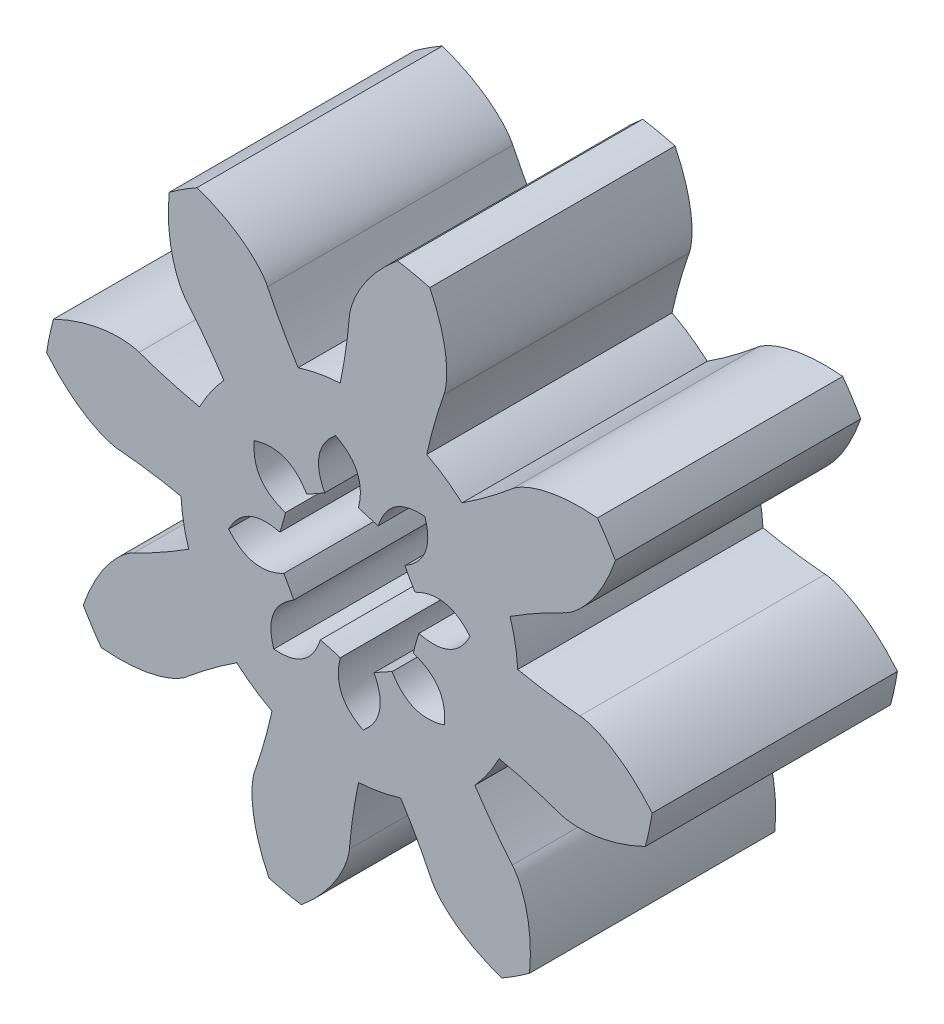
from build123d import *

# Parameters (mm, degrees)
EXTRUDE_1_DEPTH     = 6
CUT_EXTRUDE_2_DEPTH = 13.072478875


with BuildPart() as part:
    # 草图3 → 凸台-拉伸1 (new body)
    with BuildSketch(Plane.XY):
        with BuildLine():
            ThreePointArc((1.96696161, 7.237476219), (1.572644821, 7.333265866), (1.173724408, 7.407588745))
            add(Edge.make_bspline(
                [(0, 5.638155725), (0.000101301, 5.642726784), (0.000698877, 5.655536283), (0.003065727, 5.679693247), (0.008677882, 5.718928613), (0.018389094, 5.768580359), (0.033859291, 5.832228407), (0.055806057, 5.906403992), (0.083784426, 5.986918794), (0.118334002, 6.07327269), (0.156394653, 6.158200837), (0.19765593, 6.241670062), (0.24170094, 6.32361733), (0.298467235, 6.421345545), (0.371249724, 6.536317731), (0.463001824, 6.667175795), (0.57481499, 6.811191211), (0.696749171, 6.952856984), (0.823199958, 7.08792075), (0.958057827, 7.219031448), (1.061137976, 7.312626755), (1.134543326, 7.375061417), (1.172172164, 7.406301334), (1.173724408, 7.407588745)],
                knots=[0, 0, 0, 0, 0, 0.005376748, 0.015083688, 0.02853182, 0.046610139, 0.064854849, 0.092110525, 0.119476175, 0.146842495, 0.174208853, 0.201574955, 0.228941013, 0.256307345, 0.307035032, 0.361767351, 0.41649966, 0.471231936, 0.525964281, 0.580696615, 0.635428982, 0.637783596, 0.637783596, 0.637783596, 0.637783596, 0.637783596], degree=4))
            ThreePointArc((0, 5.638155725), (-0.088628717, 4.875171301), (-0.223287642, 4.118952249))
            ThreePointArc((-0.223287642, 4.118952249), (-0.744361744, 4.057283647), (-1.253391705, 3.929966187))
            ThreePointArc((-1.253391705, 3.929966187), (-1.647722087, 4.589135233), (-2.001421553, 5.270968767))
            add(Edge.make_bspline(
                [(-2.001421553, 5.270968767), (-2.003138882, 5.275206175), (-2.008244632, 5.286969324), (-2.019032532, 5.308712877), (-2.038206887, 5.343400834), (-2.064910933, 5.386371725), (-2.101967288, 5.44038309), (-2.148815468, 5.501937342), (-2.203552723, 5.567276881), (-2.266505983, 5.635742607), (-2.332235549, 5.701629081), (-2.400439414, 5.765015494), (-2.470705458, 5.825990904), (-2.558466198, 5.897203745), (-2.667321304, 5.978852139), (-2.799549757, 6.068618042), (-2.955203361, 6.16356318), (-3.119484774, 6.25271896), (-3.28564508, 6.334099394), (-3.458261702, 6.408799875), (-3.587852998, 6.459708563), (-3.678640733, 6.492019857), (-3.724908464, 6.507867851), (-3.72681662, 6.508520406)],
                knots=[0, 0, 0, 0, 0, 0.005376748, 0.015083688, 0.02853182, 0.046610139, 0.064854849, 0.092110525, 0.119476175, 0.146842495, 0.174208853, 0.201574955, 0.228941013, 0.256307345, 0.307035032, 0.361767351, 0.41649966, 0.471231936, 0.525964281, 0.580696615, 0.635428982, 0.637783596, 0.637783596, 0.637783596, 0.637783596, 0.637783596], degree=4))
            ThreePointArc((-3.72681662, 6.508520406), (-4.073374205, 6.29742984), (-4.408007746, 6.067904722))
            add(Edge.make_bspline(
                [(-3.986778146, 3.986778146), (-3.989938743, 3.990082004), (-3.998573876, 3.999562238), (-4.013981813, 4.018317406), (-4.037757014, 4.050029393), (-4.065999237, 4.092005343), (-4.100066122, 4.14795039), (-4.136997474, 4.215919156), (-4.174146342, 4.292635413), (-4.210777528, 4.378127078), (-4.243917852, 4.465093291), (-4.273763378, 4.553291075), (-4.300564322, 4.64238107), (-4.329528774, 4.751625185), (-4.359361394, 4.884387789), (-4.387013487, 5.041796946), (-4.409783915, 5.222695071), (-4.423736259, 5.409088386), (-4.429826555, 5.594007099), (-4.427176904, 5.782075277), (-4.420470108, 5.921145825), (-4.41271266, 6.017199219), (-4.408195011, 6.065896782), (-4.408007746, 6.067904722)],
                knots=[0, 0, 0, 0, 0, 0.005376748, 0.015083688, 0.02853182, 0.046610139, 0.064854849, 0.092110525, 0.119476175, 0.146842495, 0.174208853, 0.201574955, 0.228941013, 0.256307345, 0.307035032, 0.361767351, 0.41649966, 0.471231936, 0.525964281, 0.580696615, 0.635428982, 0.637783596, 0.637783596, 0.637783596, 0.637783596, 0.637783596], degree=4))
            ThreePointArc((-3.986778146, 3.986778146), (-3.509936653, 3.38459672), (-3.070427273, 2.754650861))
            ThreePointArc((-3.070427273, 2.754650861), (-3.395276017, 2.342589543), (-3.665187515, 1.892623967))
            ThreePointArc((-3.665187515, 1.892623967), (-4.410124104, 2.079893182), (-5.142356511, 2.311919007))
            add(Edge.make_bspline(
                [(-5.142356511, 2.311919007), (-5.146567146, 2.313700971), (-5.158495259, 2.318408463), (-5.181498469, 2.32615528), (-5.219584875, 2.337125052), (-5.268852496, 2.348627449), (-5.333247098, 2.360616451), (-5.409899193, 2.371015216), (-5.494806309, 2.378512162), (-5.587733565, 2.382410064), (-5.680800159, 2.382521015), (-5.773848537, 2.379114562), (-5.866650259, 2.372545092), (-5.979061557, 2.36084396), (-6.113767873, 2.341605909), (-6.270741587, 2.311580352), (-6.447941657, 2.268652984), (-6.627148815, 2.21553114), (-6.802186551, 2.155582718), (-6.977066152, 2.08634555), (-7.104698914, 2.030708544), (-7.191743073, 1.989359456), (-7.235665523, 1.967849454), (-7.237476219, 1.96696161)],
                knots=[0, 0, 0, 0, 0, 0.005376748, 0.015083688, 0.02853182, 0.046610139, 0.064854849, 0.092110525, 0.119476175, 0.146842495, 0.174208853, 0.201574955, 0.228941013, 0.256307345, 0.307035032, 0.361767351, 0.41649966, 0.471231936, 0.525964281, 0.580696615, 0.635428982, 0.637783596, 0.637783596, 0.637783596, 0.637783596, 0.637783596], degree=4))
            ThreePointArc((-7.237476219, 1.96696161), (-7.333265866, 1.572644821), (-7.407588745, 1.173724408))
            add(Edge.make_bspline(
                [(-5.638155725, 0), (-5.642726784, 0.000101301), (-5.655536283, 0.000698877), (-5.679693247, 0.003065727), (-5.718928613, 0.008677882), (-5.768580359, 0.018389094), (-5.832228407, 0.033859291), (-5.906403992, 0.055806057), (-5.986918794, 0.083784426), (-6.07327269, 0.118334002), (-6.158200837, 0.156394653), (-6.241670062, 0.19765593), (-6.32361733, 0.24170094), (-6.421345545, 0.298467235), (-6.536317731, 0.371249724), (-6.667175795, 0.463001824), (-6.811191211, 0.57481499), (-6.952856984, 0.696749171), (-7.08792075, 0.823199958), (-7.219031448, 0.958057827), (-7.312626755, 1.061137976), (-7.375061417, 1.134543326), (-7.406301334, 1.172172164), (-7.407588745, 1.173724408)],
                knots=[0, 0, 0, 0, 0, 0.005376748, 0.015083688, 0.02853182, 0.046610139, 0.064854849, 0.092110525, 0.119476175, 0.146842495, 0.174208853, 0.201574955, 0.228941013, 0.256307345, 0.307035032, 0.361767351, 0.41649966, 0.471231936, 0.525964281, 0.580696615, 0.635428982, 0.637783596, 0.637783596, 0.637783596, 0.637783596, 0.637783596], degree=4))
            ThreePointArc((-5.638155725, 0), (-4.875171301, -0.088628717), (-4.118952249, -0.223287642))
            ThreePointArc((-4.118952249, -0.223287642), (-4.057283647, -0.744361744), (-3.929966187, -1.253391705))
            ThreePointArc((-3.929966187, -1.253391705), (-4.589135233, -1.647722087), (-5.270968767, -2.001421553))
            add(Edge.make_bspline(
                [(-5.270968767, -2.001421553), (-5.275206175, -2.003138882), (-5.286969324, -2.008244632), (-5.308712877, -2.019032532), (-5.343400834, -2.038206887), (-5.386371725, -2.064910933), (-5.44038309, -2.101967288), (-5.501937342, -2.148815468), (-5.567276881, -2.203552723), (-5.635742607, -2.266505983), (-5.701629081, -2.332235549), (-5.765015494, -2.400439414), (-5.825990904, -2.470705458), (-5.897203745, -2.558466198), (-5.978852139, -2.667321304), (-6.068618042, -2.799549757), (-6.16356318, -2.955203361), (-6.25271896, -3.119484774), (-6.334099394, -3.28564508), (-6.408799875, -3.458261702), (-6.459708563, -3.587852998), (-6.492019857, -3.678640733), (-6.507867851, -3.724908464), (-6.508520406, -3.72681662)],
                knots=[0, 0, 0, 0, 0, 0.005376748, 0.015083688, 0.02853182, 0.046610139, 0.064854849, 0.092110525, 0.119476175, 0.146842495, 0.174208853, 0.201574955, 0.228941013, 0.256307345, 0.307035032, 0.361767351, 0.41649966, 0.471231936, 0.525964281, 0.580696615, 0.635428982, 0.637783596, 0.637783596, 0.637783596, 0.637783596, 0.637783596], degree=4))
            ThreePointArc((-6.508520406, -3.72681662), (-6.29742984, -4.073374205), (-6.067904722, -4.408007746))
            add(Edge.make_bspline(
                [(-3.986778146, -3.986778146), (-3.990082004, -3.989938743), (-3.999562238, -3.998573876), (-4.018317406, -4.013981813), (-4.050029393, -4.037757014), (-4.092005343, -4.065999237), (-4.14795039, -4.100066122), (-4.215919156, -4.136997474), (-4.292635413, -4.174146342), (-4.378127078, -4.210777528), (-4.465093291, -4.243917852), (-4.553291075, -4.273763378), (-4.64238107, -4.300564322), (-4.751625185, -4.329528774), (-4.884387789, -4.359361394), (-5.041796946, -4.387013487), (-5.222695071, -4.409783915), (-5.409088386, -4.423736259), (-5.594007099, -4.429826555), (-5.782075277, -4.427176904), (-5.921145825, -4.420470108), (-6.017199219, -4.41271266), (-6.065896782, -4.408195011), (-6.067904722, -4.408007746)],
                knots=[0, 0, 0, 0, 0, 0.005376748, 0.015083688, 0.02853182, 0.046610139, 0.064854849, 0.092110525, 0.119476175, 0.146842495, 0.174208853, 0.201574955, 0.228941013, 0.256307345, 0.307035032, 0.361767351, 0.41649966, 0.471231936, 0.525964281, 0.580696615, 0.635428982, 0.637783596, 0.637783596, 0.637783596, 0.637783596, 0.637783596], degree=4))
            ThreePointArc((-3.986778146, -3.986778146), (-3.38459672, -3.509936653), (-2.754650861, -3.070427273))
            ThreePointArc((-2.754650861, -3.070427273), (-2.342589543, -3.395276017), (-1.892623967, -3.665187515))
            ThreePointArc((-1.892623967, -3.665187515), (-2.079893182, -4.410124104), (-2.311919007, -5.142356511))
            add(Edge.make_bspline(
                [(-2.311919007, -5.142356511), (-2.313700971, -5.146567146), (-2.318408463, -5.158495259), (-2.32615528, -5.181498469), (-2.337125052, -5.219584875), (-2.348627449, -5.268852496), (-2.360616451, -5.333247098), (-2.371015216, -5.409899193), (-2.378512162, -5.494806309), (-2.382410064, -5.587733565), (-2.382521015, -5.680800159), (-2.379114562, -5.773848537), (-2.372545092, -5.866650259), (-2.36084396, -5.979061557), (-2.341605909, -6.113767873), (-2.311580352, -6.270741587), (-2.268652984, -6.447941657), (-2.21553114, -6.627148815), (-2.155582718, -6.802186551), (-2.08634555, -6.977066152), (-2.030708544, -7.104698914), (-1.989359456, -7.191743073), (-1.967849454, -7.235665523), (-1.96696161, -7.237476219)],
                knots=[0, 0, 0, 0, 0, 0.005376748, 0.015083688, 0.02853182, 0.046610139, 0.064854849, 0.092110525, 0.119476175, 0.146842495, 0.174208853, 0.201574955, 0.228941013, 0.256307345, 0.307035032, 0.361767351, 0.41649966, 0.471231936, 0.525964281, 0.580696615, 0.635428982, 0.637783596, 0.637783596, 0.637783596, 0.637783596, 0.637783596], degree=4))
            ThreePointArc((-1.96696161, -7.237476219), (-1.572644821, -7.333265866), (-1.173724408, -7.407588745))
            add(Edge.make_bspline(
                [(0, -5.638155725), (-0.000101301, -5.642726784), (-0.000698877, -5.655536283), (-0.003065727, -5.679693247), (-0.008677882, -5.718928613), (-0.018389094, -5.768580359), (-0.033859291, -5.832228407), (-0.055806057, -5.906403992), (-0.083784426, -5.986918794), (-0.118334002, -6.07327269), (-0.156394653, -6.158200837), (-0.19765593, -6.241670062), (-0.24170094, -6.32361733), (-0.298467235, -6.421345545), (-0.371249724, -6.536317731), (-0.463001824, -6.667175795), (-0.57481499, -6.811191211), (-0.696749171, -6.952856984), (-0.823199958, -7.08792075), (-0.958057827, -7.219031448), (-1.061137976, -7.312626755), (-1.134543326, -7.375061417), (-1.172172164, -7.406301334), (-1.173724408, -7.407588745)],
                knots=[0, 0, 0, 0, 0, 0.005376748, 0.015083688, 0.02853182, 0.046610139, 0.064854849, 0.092110525, 0.119476175, 0.146842495, 0.174208853, 0.201574955, 0.228941013, 0.256307345, 0.307035032, 0.361767351, 0.41649966, 0.471231936, 0.525964281, 0.580696615, 0.635428982, 0.637783596, 0.637783596, 0.637783596, 0.637783596, 0.637783596], degree=4))
            ThreePointArc((0, -5.638155725), (0.088628717, -4.875171301), (0.223287642, -4.118952249))
            ThreePointArc((0.223287642, -4.118952249), (0.744361744, -4.057283647), (1.253391705, -3.929966187))
            ThreePointArc((1.253391705, -3.929966187), (1.647722087, -4.589135233), (2.001421553, -5.270968767))
            add(Edge.make_bspline(
                [(2.001421553, -5.270968767), (2.003138882, -5.275206175), (2.008244632, -5.286969324), (2.019032532, -5.308712877), (2.038206887, -5.343400834), (2.064910933, -5.386371725), (2.101967288, -5.44038309), (2.148815468, -5.501937342), (2.203552723, -5.567276881), (2.266505983, -5.635742607), (2.332235549, -5.701629081), (2.400439414, -5.765015494), (2.470705458, -5.825990904), (2.558466198, -5.897203745), (2.667321304, -5.978852139), (2.799549757, -6.068618042), (2.955203361, -6.16356318), (3.119484774, -6.25271896), (3.28564508, -6.334099394), (3.458261702, -6.408799875), (3.587852998, -6.459708563), (3.678640733, -6.492019857), (3.724908464, -6.507867851), (3.72681662, -6.508520406)],
                knots=[0, 0, 0, 0, 0, 0.005376748, 0.015083688, 0.02853182, 0.046610139, 0.064854849, 0.092110525, 0.119476175, 0.146842495, 0.174208853, 0.201574955, 0.228941013, 0.256307345, 0.307035032, 0.361767351, 0.41649966, 0.471231936, 0.525964281, 0.580696615, 0.635428982, 0.637783596, 0.637783596, 0.637783596, 0.637783596, 0.637783596], degree=4))
            ThreePointArc((3.72681662, -6.508520406), (4.073374205, -6.29742984), (4.408007746, -6.067904722))
            add(Edge.make_bspline(
                [(3.986778146, -3.986778146), (3.989938743, -3.990082004), (3.998573876, -3.999562238), (4.013981813, -4.018317406), (4.037757014, -4.050029393), (4.065999237, -4.092005343), (4.100066122, -4.14795039), (4.136997474, -4.215919156), (4.174146342, -4.292635413), (4.210777528, -4.378127078), (4.243917852, -4.465093291), (4.273763378, -4.553291075), (4.300564322, -4.64238107), (4.329528774, -4.751625185), (4.359361394, -4.884387789), (4.387013487, -5.041796946), (4.409783915, -5.222695071), (4.423736259, -5.409088386), (4.429826555, -5.594007099), (4.427176904, -5.782075277), (4.420470108, -5.921145825), (4.41271266, -6.017199219), (4.408195011, -6.065896782), (4.408007746, -6.067904722)],
                knots=[0, 0, 0, 0, 0, 0.005376748, 0.015083688, 0.02853182, 0.046610139, 0.064854849, 0.092110525, 0.119476175, 0.146842495, 0.174208853, 0.201574955, 0.228941013, 0.256307345, 0.307035032, 0.361767351, 0.41649966, 0.471231936, 0.525964281, 0.580696615, 0.635428982, 0.637783596, 0.637783596, 0.637783596, 0.637783596, 0.637783596], degree=4))
            ThreePointArc((3.986778146, -3.986778146), (3.509936653, -3.38459672), (3.070427273, -2.754650861))
            ThreePointArc((3.070427273, -2.754650861), (3.395276017, -2.342589543), (3.665187515, -1.892623967))
            ThreePointArc((3.665187515, -1.892623967), (4.410124104, -2.079893182), (5.142356511, -2.311919007))
            add(Edge.make_bspline(
                [(5.142356511, -2.311919007), (5.146567146, -2.313700971), (5.158495259, -2.318408463), (5.181498469, -2.32615528), (5.219584875, -2.337125052), (5.268852496, -2.348627449), (5.333247098, -2.360616451), (5.409899193, -2.371015216), (5.494806309, -2.378512162), (5.587733565, -2.382410064), (5.680800159, -2.382521015), (5.773848537, -2.379114562), (5.866650259, -2.372545092), (5.979061557, -2.36084396), (6.113767873, -2.341605909), (6.270741587, -2.311580352), (6.447941657, -2.268652984), (6.627148815, -2.21553114), (6.802186551, -2.155582718), (6.977066152, -2.08634555), (7.104698914, -2.030708544), (7.191743073, -1.989359456), (7.235665523, -1.967849454), (7.237476219, -1.96696161)],
                knots=[0, 0, 0, 0, 0, 0.005376748, 0.015083688, 0.02853182, 0.046610139, 0.064854849, 0.092110525, 0.119476175, 0.146842495, 0.174208853, 0.201574955, 0.228941013, 0.256307345, 0.307035032, 0.361767351, 0.41649966, 0.471231936, 0.525964281, 0.580696615, 0.635428982, 0.637783596, 0.637783596, 0.637783596, 0.637783596, 0.637783596], degree=4))
            ThreePointArc((7.237476219, -1.96696161), (7.333265866, -1.572644821), (7.407588745, -1.173724408))
            add(Edge.make_bspline(
                [(5.638155725, 0), (5.642726784, -0.000101301), (5.655536283, -0.000698877), (5.679693247, -0.003065727), (5.718928613, -0.008677882), (5.768580359, -0.018389094), (5.832228407, -0.033859291), (5.906403992, -0.055806057), (5.986918794, -0.083784426), (6.07327269, -0.118334002), (6.158200837, -0.156394653), (6.241670062, -0.19765593), (6.32361733, -0.24170094), (6.421345545, -0.298467235), (6.536317731, -0.371249724), (6.667175795, -0.463001824), (6.811191211, -0.57481499), (6.952856984, -0.696749171), (7.08792075, -0.823199958), (7.219031448, -0.958057827), (7.312626755, -1.061137976), (7.375061417, -1.134543326), (7.406301334, -1.172172164), (7.407588745, -1.173724408)],
                knots=[0, 0, 0, 0, 0, 0.005376748, 0.015083688, 0.02853182, 0.046610139, 0.064854849, 0.092110525, 0.119476175, 0.146842495, 0.174208853, 0.201574955, 0.228941013, 0.256307345, 0.307035032, 0.361767351, 0.41649966, 0.471231936, 0.525964281, 0.580696615, 0.635428982, 0.637783596, 0.637783596, 0.637783596, 0.637783596, 0.637783596], degree=4))
            ThreePointArc((5.638155725, 0), (4.875171301, 0.088628717), (4.118952249, 0.223287642))
            ThreePointArc((4.118952249, 0.223287642), (4.057283647, 0.744361744), (3.929966187, 1.253391705))
            ThreePointArc((3.929966187, 1.253391705), (4.589135233, 1.647722087), (5.270968767, 2.001421553))
            add(Edge.make_bspline(
                [(5.270968767, 2.001421553), (5.275206175, 2.003138882), (5.286969324, 2.008244632), (5.308712877, 2.019032532), (5.343400834, 2.038206887), (5.386371725, 2.064910933), (5.44038309, 2.101967288), (5.501937342, 2.148815468), (5.567276881, 2.203552723), (5.635742607, 2.266505983), (5.701629081, 2.332235549), (5.765015494, 2.400439414), (5.825990904, 2.470705458), (5.897203745, 2.558466198), (5.978852139, 2.667321304), (6.068618042, 2.799549757), (6.16356318, 2.955203361), (6.25271896, 3.119484774), (6.334099394, 3.28564508), (6.408799875, 3.458261702), (6.459708563, 3.587852998), (6.492019857, 3.678640733), (6.507867851, 3.724908464), (6.508520406, 3.72681662)],
                knots=[0, 0, 0, 0, 0, 0.005376748, 0.015083688, 0.02853182, 0.046610139, 0.064854849, 0.092110525, 0.119476175, 0.146842495, 0.174208853, 0.201574955, 0.228941013, 0.256307345, 0.307035032, 0.361767351, 0.41649966, 0.471231936, 0.525964281, 0.580696615, 0.635428982, 0.637783596, 0.637783596, 0.637783596, 0.637783596, 0.637783596], degree=4))
            ThreePointArc((6.508520406, 3.72681662), (6.29742984, 4.073374205), (6.067904722, 4.408007746))
            add(Edge.make_bspline(
                [(3.986778146, 3.986778146), (3.990082004, 3.989938743), (3.999562238, 3.998573876), (4.018317406, 4.013981813), (4.050029393, 4.037757014), (4.092005343, 4.065999237), (4.14795039, 4.100066122), (4.215919156, 4.136997474), (4.292635413, 4.174146342), (4.378127078, 4.210777528), (4.465093291, 4.243917852), (4.553291075, 4.273763378), (4.64238107, 4.300564322), (4.751625185, 4.329528774), (4.884387789, 4.359361394), (5.041796946, 4.387013487), (5.222695071, 4.409783915), (5.409088386, 4.423736259), (5.594007099, 4.429826555), (5.782075277, 4.427176904), (5.921145825, 4.420470108), (6.017199219, 4.41271266), (6.065896782, 4.408195011), (6.067904722, 4.408007746)],
                knots=[0, 0, 0, 0, 0, 0.005376748, 0.015083688, 0.02853182, 0.046610139, 0.064854849, 0.092110525, 0.119476175, 0.146842495, 0.174208853, 0.201574955, 0.228941013, 0.256307345, 0.307035032, 0.361767351, 0.41649966, 0.471231936, 0.525964281, 0.580696615, 0.635428982, 0.637783596, 0.637783596, 0.637783596, 0.637783596, 0.637783596], degree=4))
            ThreePointArc((3.986778146, 3.986778146), (3.38459672, 3.509936653), (2.754650861, 3.070427273))
            ThreePointArc((2.754650861, 3.070427273), (2.342589543, 3.395276017), (1.892623967, 3.665187515))
            ThreePointArc((1.892623967, 3.665187515), (2.079893182, 4.410124104), (2.311919007, 5.142356511))
            add(Edge.make_bspline(
                [(2.311919007, 5.142356511), (2.313700971, 5.146567146), (2.318408463, 5.158495259), (2.32615528, 5.181498469), (2.337125052, 5.219584875), (2.348627449, 5.268852496), (2.360616451, 5.333247098), (2.371015216, 5.409899193), (2.378512162, 5.494806309), (2.382410064, 5.587733565), (2.382521015, 5.680800159), (2.379114562, 5.773848537), (2.372545092, 5.866650259), (2.36084396, 5.979061557), (2.341605909, 6.113767873), (2.311580352, 6.270741587), (2.268652984, 6.447941657), (2.21553114, 6.627148815), (2.155582718, 6.802186551), (2.08634555, 6.977066152), (2.030708544, 7.104698914), (1.989359456, 7.191743073), (1.967849454, 7.235665523), (1.96696161, 7.237476219)],
                knots=[0, 0, 0, 0, 0, 0.005376748, 0.015083688, 0.02853182, 0.046610139, 0.064854849, 0.092110525, 0.119476175, 0.146842495, 0.174208853, 0.201574955, 0.228941013, 0.256307345, 0.307035032, 0.361767351, 0.41649966, 0.471231936, 0.525964281, 0.580696615, 0.635428982, 0.637783596, 0.637783596, 0.637783596, 0.637783596, 0.637783596], degree=4))
        make_face()
    extrude(amount=EXTRUDE_1_DEPTH)

    # 草图4 → 切除-拉伸2 (cut, through all)
    with BuildSketch(Plane.XY.offset(6)):
        with BuildLine():
            ThreePointArc((-1.043891703, 1.359728736), (-0.821449828, 1.478325695), (-0.603258423, 1.60457203))
            add(Edge.make_bspline(
                [(-0.603258423, 1.60457203), (-1.006319092, 2.389184244), (-0.339505729, 2.952641353)],
                knots=[0, 0, 0, 1, 1, 1], degree=2))
            add(Edge.make_bspline(
                [(0.223330508, 1.699616312), (0.437791479, 2.55523347), (-0.339505729, 2.952641353)],
                knots=[0, 0, 0, 1, 1, 1], degree=2))
            ThreePointArc((0.223330508, 1.699616312), (0.46448138, 1.626186867), (0.708035642, 1.561171885))
            add(Edge.make_bspline(
                [(0.708035642, 1.561171885), (0.977833326, 2.400983434), (1.84776592, 2.327899526)],
                knots=[0, 0, 0, 1, 1, 1], degree=2))
            add(Edge.make_bspline(
                [(1.359728736, 1.043891703), (2.116388238, 1.497257591), (1.84776592, 2.327899526)],
                knots=[0, 0, 0, 1, 1, 1], degree=2))
            ThreePointArc((1.359728736, 1.043891703), (1.478325695, 0.821449828), (1.60457203, 0.603258423))
            add(Edge.make_bspline(
                [(1.60457203, 0.603258423), (2.389184244, 1.006319092), (2.952641353, 0.339505729)],
                knots=[0, 0, 0, 1, 1, 1], degree=2))
            add(Edge.make_bspline(
                [(1.699616312, -0.223330508), (2.55523347, -0.437791479), (2.952641353, 0.339505729)],
                knots=[0, 0, 0, 1, 1, 1], degree=2))
            ThreePointArc((1.699616312, -0.223330508), (1.626186867, -0.46448138), (1.561171885, -0.708035642))
            add(Edge.make_bspline(
                [(1.561171885, -0.708035642), (2.400983434, -0.977833326), (2.327899526, -1.84776592)],
                knots=[0, 0, 0, 1, 1, 1], degree=2))
            add(Edge.make_bspline(
                [(1.043891703, -1.359728736), (1.497257591, -2.116388238), (2.327899526, -1.84776592)],
                knots=[0, 0, 0, 1, 1, 1], degree=2))
            ThreePointArc((1.043891703, -1.359728736), (0.821449828, -1.478325695), (0.603258423, -1.60457203))
            add(Edge.make_bspline(
                [(0.603258423, -1.60457203), (1.006319092, -2.389184244), (0.339505729, -2.952641353)],
                knots=[0, 0, 0, 1, 1, 1], degree=2))
            add(Edge.make_bspline(
                [(-0.223330508, -1.699616312), (-0.437791479, -2.55523347), (0.339505729, -2.952641353)],
                knots=[0, 0, 0, 1, 1, 1], degree=2))
            ThreePointArc((-0.223330508, -1.699616312), (-0.46448138, -1.626186867), (-0.708035642, -1.561171885))
            add(Edge.make_bspline(
                [(-0.708035642, -1.561171885), (-0.977833326, -2.400983434), (-1.84776592, -2.327899526)],
                knots=[0, 0, 0, 1, 1, 1], degree=2))
            add(Edge.make_bspline(
                [(-1.359728736, -1.043891703), (-2.116388238, -1.497257591), (-1.84776592, -2.327899526)],
                knots=[0, 0, 0, 1, 1, 1], degree=2))
            ThreePointArc((-1.359728736, -1.043891703), (-1.478325695, -0.821449828), (-1.60457203, -0.603258423))
            add(Edge.make_bspline(
                [(-1.60457203, -0.603258423), (-2.389184244, -1.006319092), (-2.952641353, -0.339505729)],
                knots=[0, 0, 0, 1, 1, 1], degree=2))
            add(Edge.make_bspline(
                [(-1.699616312, 0.223330508), (-2.55523347, 0.437791479), (-2.952641353, -0.339505729)],
                knots=[0, 0, 0, 1, 1, 1], degree=2))
            ThreePointArc((-1.699616312, 0.223330508), (-1.626186867, 0.46448138), (-1.561171885, 0.708035642))
            add(Edge.make_bspline(
                [(-1.561171885, 0.708035642), (-2.400983434, 0.977833326), (-2.327899526, 1.84776592)],
                knots=[0, 0, 0, 1, 1, 1], degree=2))
            add(Edge.make_bspline(
                [(-1.043891703, 1.359728736), (-1.497257591, 2.116388238), (-2.327899526, 1.84776592)],
                knots=[0, 0, 0, 1, 1, 1], degree=2))
        make_face()
    extrude(amount=-CUT_EXTRUDE_2_DEPTH, mode=Mode.SUBTRACT)


solid = part.part
